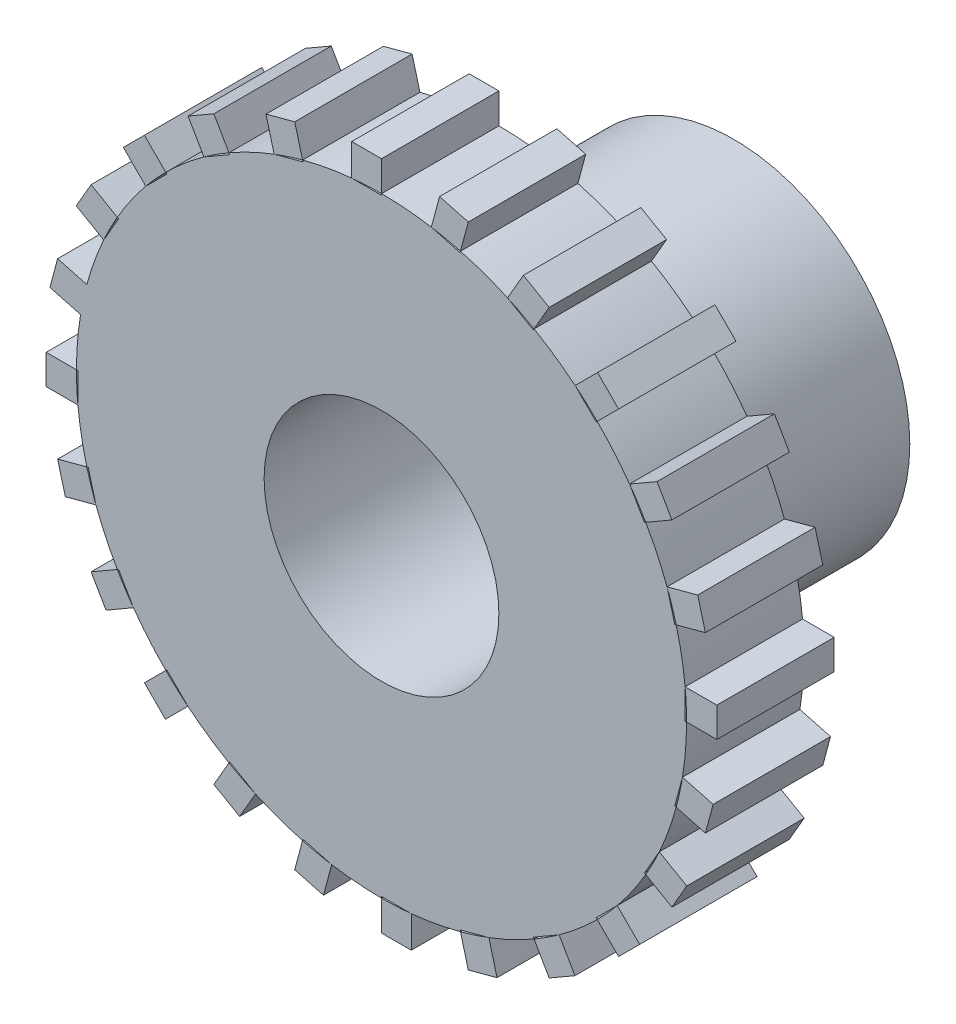
from build123d import *

# Parameters (mm, degrees)
SKETCH1_R           = 9.525
SKETCH1_R_2         = 6.35
BOSS_EXTRUDE1_DEPTH = 12.7
SKETCH2_R           = 6.35
BOSS_EXTRUDE2_DEPTH = 6.35


with BuildPart() as part:
    # Sketch1 → Boss-Extrude1 (new body)
    with BuildSketch(Plane.XY):
        Circle(SKETCH1_R)
        Circle(SKETCH1_R_2, mode=Mode.SUBTRACT)
    extrude(amount=BOSS_EXTRUDE1_DEPTH)

    # Sketch2 → Boss-Extrude2 (add)
    # profile 1 of 24: a face of its own
    with BuildSketch(Plane.XY.offset(12.7)):
        with BuildLine():
            Line((3.139117874, 17.93550241), (2.695169358, 16.278663993))
            ThreePointArc((2.695169358, 16.278663993), (3.487038215, 16.127597581), (4.27058357, 15.938034861))
            Line((4.27058357, 15.938034861), (4.694156627, 17.518831032))
            Line((4.694156627, 17.518831032), (3.139117874, 17.93550241))
        make_face()
    # profile 2 of 24: a face of its own
    with BuildSketch(Plane.XY.offset(12.7)):
        with BuildLine():
            Line((4.250208111, 15.861992615), (2.695169358, 16.278663993))
            ThreePointArc((2.695169358, 16.278663993), (1.352132218, 16.444773569), (0, 16.500267854))
            Line((0, 16.500267854), (0, 16.421543128))
            Line((0, 16.421543128), (-1.609894581, 16.421543128))
            ThreePointArc((-1.609894581, 16.421543128), (-2.950161162, 16.234389067), (-4.27058357, 15.938034861))
            Line((-4.27058357, 15.938034861), (-4.250208111, 15.861992615))
            Line((-4.250208111, 15.861992615), (-5.805246865, 15.445321237))
            ThreePointArc((-5.805246865, 15.445321237), (-7.051405934, 14.917657779), (-8.250133927, 14.289651131))
            Line((-8.250133927, 14.289651131), (-8.210771564, 14.221473518))
            Line((-8.210771564, 14.221473518), (-9.604981168, 13.416526228))
            ThreePointArc((-9.604981168, 13.416526228), (-10.672109045, 12.584312766), (-11.667451291, 11.667451291))
            Line((-11.667451291, 11.667451291), (-11.611784503, 11.611784503))
            Line((-11.611784503, 11.611784503), (-12.750151878, 10.473417128))
            ThreePointArc((-12.750151878, 10.473417128), (-13.565525561, 9.393367634), (-14.289651131, 8.250133927))
            Line((-14.289651131, 8.250133927), (-14.221473518, 8.210771564))
            Line((-14.221473518, 8.210771564), (-15.026420809, 6.816561959))
            ThreePointArc((-15.026420809, 6.816561959), (-15.534473928, 5.562280022), (-15.938034861, 4.27058357))
            Line((-15.938034861, 4.27058357), (-17.518831032, 4.694156627))
            Line((-17.518831032, 4.694156627), (-17.93550241, 3.139117874))
            Line((-17.93550241, 3.139117874), (-16.278663993, 2.695169358))
            ThreePointArc((-16.278663993, 2.695169358), (-16.444773569, 1.352132218), (-16.500267854, 0))
            Line((-16.500267854, 0), (-16.421543128, 0))
            Line((-16.421543128, 0), (-16.421543128, -1.609894581))
            ThreePointArc((-16.421543128, -1.609894581), (-16.234389067, -2.950161162), (-15.938034861, -4.27058357))
            Line((-15.938034861, -4.27058357), (-15.861992615, -4.250208111))
            Line((-15.861992615, -4.250208111), (-15.445321237, -5.805246865))
            ThreePointArc((-15.445321237, -5.805246865), (-14.917657779, -7.051405934), (-14.289651131, -8.250133927))
            Line((-14.289651131, -8.250133927), (-14.221473518, -8.210771564))
            Line((-14.221473518, -8.210771564), (-13.416526228, -9.604981168))
            ThreePointArc((-13.416526228, -9.604981168), (-12.584312766, -10.672109045), (-11.667451291, -11.667451291))
            Line((-11.667451291, -11.667451291), (-11.611784503, -11.611784503))
            Line((-11.611784503, -11.611784503), (-10.473417128, -12.750151878))
            ThreePointArc((-10.473417128, -12.750151878), (-9.393367634, -13.565525561), (-8.250133927, -14.289651131))
            Line((-8.250133927, -14.289651131), (-8.210771564, -14.221473518))
            Line((-8.210771564, -14.221473518), (-6.816561959, -15.026420809))
            ThreePointArc((-6.816561959, -15.026420809), (-5.562280022, -15.534473928), (-4.27058357, -15.938034861))
            Line((-4.27058357, -15.938034861), (-4.250208111, -15.861992615))
            Line((-4.250208111, -15.861992615), (-2.695169358, -16.278663993))
            ThreePointArc((-2.695169358, -16.278663993), (-1.352132218, -16.444773569), (0, -16.500267854))
            Line((0, -16.500267854), (0, -16.421543128))
            Line((0, -16.421543128), (1.609894581, -16.421543128))
            ThreePointArc((1.609894581, -16.421543128), (2.950161162, -16.234389067), (4.27058357, -15.938034861))
            Line((4.27058357, -15.938034861), (4.250208111, -15.861992615))
            Line((4.250208111, -15.861992615), (5.805246865, -15.445321237))
            ThreePointArc((5.805246865, -15.445321237), (7.051405934, -14.917657779), (8.250133927, -14.289651131))
            Line((8.250133927, -14.289651131), (8.210771564, -14.221473518))
            Line((8.210771564, -14.221473518), (9.604981168, -13.416526228))
            ThreePointArc((9.604981168, -13.416526228), (10.672109045, -12.584312766), (11.667451291, -11.667451291))
            Line((11.667451291, -11.667451291), (11.611784503, -11.611784503))
            Line((11.611784503, -11.611784503), (12.750151878, -10.473417128))
            ThreePointArc((12.750151878, -10.473417128), (13.565525561, -9.393367634), (14.289651131, -8.250133927))
            Line((14.289651131, -8.250133927), (14.221473518, -8.210771564))
            Line((14.221473518, -8.210771564), (15.026420809, -6.816561959))
            ThreePointArc((15.026420809, -6.816561959), (15.534473928, -5.562280022), (15.938034861, -4.27058357))
            Line((15.938034861, -4.27058357), (15.861992615, -4.250208111))
            Line((15.861992615, -4.250208111), (16.278663993, -2.695169358))
            ThreePointArc((16.278663993, -2.695169358), (16.444773569, -1.352132218), (16.500267854, 0))
            Line((16.500267854, 0), (16.421543128, 0))
            Line((16.421543128, 0), (16.421543128, 1.609894581))
            ThreePointArc((16.421543128, 1.609894581), (16.234389067, 2.950161162), (15.938034861, 4.27058357))
            Line((15.938034861, 4.27058357), (15.861992615, 4.250208111))
            Line((15.861992615, 4.250208111), (15.445321237, 5.805246865))
            ThreePointArc((15.445321237, 5.805246865), (14.917657779, 7.051405934), (14.289651131, 8.250133927))
            Line((14.289651131, 8.250133927), (14.221473518, 8.210771564))
            Line((14.221473518, 8.210771564), (13.416526228, 9.604981168))
            ThreePointArc((13.416526228, 9.604981168), (12.584312766, 10.672109045), (11.667451291, 11.667451291))
            Line((11.667451291, 11.667451291), (11.611784503, 11.611784503))
            Line((11.611784503, 11.611784503), (10.473417128, 12.750151878))
            ThreePointArc((10.473417128, 12.750151878), (9.393367634, 13.565525561), (8.250133927, 14.289651131))
            Line((8.250133927, 14.289651131), (8.210771564, 14.221473518))
            Line((8.210771564, 14.221473518), (6.816561959, 15.026420809))
            ThreePointArc((6.816561959, 15.026420809), (5.562280022, 15.534473928), (4.27058357, 15.938034861))
            Line((4.27058357, 15.938034861), (4.250208111, 15.861992615))
        make_face()
        Circle(SKETCH2_R, mode=Mode.SUBTRACT)
    # profile 3 of 24: a face of its own
    with BuildSketch(Plane.XY.offset(12.7)):
        with BuildLine():
            ThreePointArc((-1.609894581, 16.421543128), (-0.805909136, 16.480574921), (0, 16.500267854))
            Line((0, 16.500267854), (0, 18.136828476))
            Line((0, 18.136828476), (-1.609894581, 18.136828476))
            Line((-1.609894581, 18.136828476), (-1.609894581, 16.421543128))
        make_face()
    # profile 4 of 24: a face of its own
    with BuildSketch(Plane.XY.offset(12.7)):
        with BuildLine():
            Line((7.674204634, 16.511901495), (6.816561959, 15.026420809))
            ThreePointArc((6.816561959, 15.026420809), (7.542349675, 14.675551119), (8.250133927, 14.289651131))
            Line((8.250133927, 14.289651131), (9.068414238, 15.706954204))
            Line((9.068414238, 15.706954204), (7.674204634, 16.511901495))
        make_face()
    # profile 5 of 24: a face of its own
    with BuildSketch(Plane.XY.offset(12.7)):
        with BuildLine():
            ThreePointArc((-5.805246865, 15.445321237), (-5.043935112, 15.710428315), (-4.27058357, 15.938034861))
            Line((-4.27058357, 15.938034861), (-4.694156627, 17.518831032))
            Line((-4.694156627, 17.518831032), (-6.249195381, 17.102159654))
            Line((-6.249195381, 17.102159654), (-5.805246865, 15.445321237))
        make_face()
    # profile 6 of 24: a face of its own
    with BuildSketch(Plane.XY.offset(12.7)):
        with BuildLine():
            Line((11.68630703, 13.96304178), (10.473417128, 12.750151878))
            ThreePointArc((10.473417128, 12.750151878), (11.083662469, 12.2233901), (11.667451291, 11.667451291))
            Line((11.667451291, 11.667451291), (12.824674405, 12.824674405))
            Line((12.824674405, 12.824674405), (11.68630703, 13.96304178))
        make_face()
    # profile 7 of 24: a face of its own
    with BuildSketch(Plane.XY.offset(12.7)):
        with BuildLine():
            ThreePointArc((-9.604981168, 13.416526228), (-8.938225246, 13.869641982), (-8.250133927, 14.289651131))
            Line((-8.250133927, 14.289651131), (-9.068414238, 15.706954204))
            Line((-9.068414238, 15.706954204), (-10.462623843, 14.902006914))
            Line((-10.462623843, 14.902006914), (-9.604981168, 13.416526228))
        make_face()
    # profile 8 of 24: a face of its own
    with BuildSketch(Plane.XY.offset(12.7)):
        with BuildLine():
            Line((14.902006914, 10.462623843), (13.416526228, 9.604981168))
            ThreePointArc((13.416526228, 9.604981168), (13.869641982, 8.938225246), (14.289651131, 8.250133927))
            Line((14.289651131, 8.250133927), (15.706954204, 9.068414238))
            Line((15.706954204, 9.068414238), (14.902006914, 10.462623843))
        make_face()
    # profile 9 of 24: a face of its own
    with BuildSketch(Plane.XY.offset(12.7)):
        with BuildLine():
            ThreePointArc((-12.750151878, 10.473417128), (-12.2233901, 11.083662469), (-11.667451291, 11.667451291))
            Line((-11.667451291, 11.667451291), (-12.824674405, 12.824674405))
            Line((-12.824674405, 12.824674405), (-13.96304178, 11.68630703))
            Line((-13.96304178, 11.68630703), (-12.750151878, 10.473417128))
        make_face()
    # profile 10 of 24: a face of its own
    with BuildSketch(Plane.XY.offset(12.7)):
        with BuildLine():
            Line((17.102159654, 6.249195381), (15.445321237, 5.805246865))
            ThreePointArc((15.445321237, 5.805246865), (15.710428315, 5.043935112), (15.938034861, 4.27058357))
            Line((15.938034861, 4.27058357), (17.518831032, 4.694156627))
            Line((17.518831032, 4.694156627), (17.102159654, 6.249195381))
        make_face()
    # profile 11 of 24: a face of its own
    with BuildSketch(Plane.XY.offset(12.7)):
        with BuildLine():
            ThreePointArc((-15.026420809, 6.816561959), (-14.675551119, 7.542349675), (-14.289651131, 8.250133927))
            Line((-14.289651131, 8.250133927), (-15.706954204, 9.068414238))
            Line((-15.706954204, 9.068414238), (-16.511901495, 7.674204634))
            Line((-16.511901495, 7.674204634), (-15.026420809, 6.816561959))
        make_face()
    # profile 12 of 24: a face of its own
    with BuildSketch(Plane.XY.offset(12.7)):
        with BuildLine():
            Line((18.136828476, 1.609894581), (16.421543128, 1.609894581))
            ThreePointArc((16.421543128, 1.609894581), (16.480574921, 0.805909136), (16.500267854, 0))
            Line((16.500267854, 0), (18.136828476, 0))
            Line((18.136828476, 0), (18.136828476, 1.609894581))
        make_face()
    # profile 13 of 24: a face of its own
    with BuildSketch(Plane.XY.offset(12.7)):
        with BuildLine():
            Line((17.93550241, -3.139117874), (16.278663993, -2.695169358))
            ThreePointArc((16.278663993, -2.695169358), (16.127597581, -3.487038215), (15.938034861, -4.27058357))
            Line((15.938034861, -4.27058357), (17.518831032, -4.694156627))
            Line((17.518831032, -4.694156627), (17.93550241, -3.139117874))
        make_face()
    # profile 14 of 24: a face of its own
    with BuildSketch(Plane.XY.offset(12.7)):
        with BuildLine():
            ThreePointArc((-16.421543128, -1.609894581), (-16.480574921, -0.805909136), (-16.500267854, 0))
            Line((-16.500267854, 0), (-18.136828476, 0))
            Line((-18.136828476, 0), (-18.136828476, -1.609894581))
            Line((-18.136828476, -1.609894581), (-16.421543128, -1.609894581))
        make_face()
    # profile 15 of 24: a face of its own
    with BuildSketch(Plane.XY.offset(12.7)):
        with BuildLine():
            Line((16.511901495, -7.674204634), (15.026420809, -6.816561959))
            ThreePointArc((15.026420809, -6.816561959), (14.675551119, -7.542349675), (14.289651131, -8.250133927))
            Line((14.289651131, -8.250133927), (15.706954204, -9.068414238))
            Line((15.706954204, -9.068414238), (16.511901495, -7.674204634))
        make_face()
    # profile 16 of 24: a face of its own
    with BuildSketch(Plane.XY.offset(12.7)):
        with BuildLine():
            ThreePointArc((-15.445321237, -5.805246865), (-15.710428315, -5.043935112), (-15.938034861, -4.27058357))
            Line((-15.938034861, -4.27058357), (-17.518831032, -4.694156627))
            Line((-17.518831032, -4.694156627), (-17.102159654, -6.249195381))
            Line((-17.102159654, -6.249195381), (-15.445321237, -5.805246865))
        make_face()
    # profile 17 of 24: a face of its own
    with BuildSketch(Plane.XY.offset(12.7)):
        with BuildLine():
            Line((13.96304178, -11.68630703), (12.750151878, -10.473417128))
            ThreePointArc((12.750151878, -10.473417128), (12.2233901, -11.083662469), (11.667451291, -11.667451291))
            Line((11.667451291, -11.667451291), (12.824674405, -12.824674405))
            Line((12.824674405, -12.824674405), (13.96304178, -11.68630703))
        make_face()
    # profile 18 of 24: a face of its own
    with BuildSketch(Plane.XY.offset(12.7)):
        with BuildLine():
            ThreePointArc((-13.416526228, -9.604981168), (-13.869641982, -8.938225246), (-14.289651131, -8.250133927))
            Line((-14.289651131, -8.250133927), (-15.706954204, -9.068414238))
            Line((-15.706954204, -9.068414238), (-14.902006914, -10.462623843))
            Line((-14.902006914, -10.462623843), (-13.416526228, -9.604981168))
        make_face()
    # profile 19 of 24: a face of its own
    with BuildSketch(Plane.XY.offset(12.7)):
        with BuildLine():
            Line((10.462623843, -14.902006914), (9.604981168, -13.416526228))
            ThreePointArc((9.604981168, -13.416526228), (8.938225246, -13.869641982), (8.250133927, -14.289651131))
            Line((8.250133927, -14.289651131), (9.068414238, -15.706954204))
            Line((9.068414238, -15.706954204), (10.462623843, -14.902006914))
        make_face()
    # profile 20 of 24: a face of its own
    with BuildSketch(Plane.XY.offset(12.7)):
        with BuildLine():
            ThreePointArc((-10.473417128, -12.750151878), (-11.083662469, -12.2233901), (-11.667451291, -11.667451291))
            Line((-11.667451291, -11.667451291), (-12.824674405, -12.824674405))
            Line((-12.824674405, -12.824674405), (-11.68630703, -13.96304178))
            Line((-11.68630703, -13.96304178), (-10.473417128, -12.750151878))
        make_face()
    # profile 21 of 24: a face of its own
    with BuildSketch(Plane.XY.offset(12.7)):
        with BuildLine():
            Line((6.249195381, -17.102159654), (5.805246865, -15.445321237))
            ThreePointArc((5.805246865, -15.445321237), (5.043935112, -15.710428315), (4.27058357, -15.938034861))
            Line((4.27058357, -15.938034861), (4.694156627, -17.518831032))
            Line((4.694156627, -17.518831032), (6.249195381, -17.102159654))
        make_face()
    # profile 22 of 24: a face of its own
    with BuildSketch(Plane.XY.offset(12.7)):
        with BuildLine():
            ThreePointArc((-6.816561959, -15.026420809), (-7.542349675, -14.675551119), (-8.250133927, -14.289651131))
            Line((-8.250133927, -14.289651131), (-9.068414238, -15.706954204))
            Line((-9.068414238, -15.706954204), (-7.674204634, -16.511901495))
            Line((-7.674204634, -16.511901495), (-6.816561959, -15.026420809))
        make_face()
    # profile 23 of 24: a face of its own
    with BuildSketch(Plane.XY.offset(12.7)):
        with BuildLine():
            Line((1.609894581, -18.136828476), (1.609894581, -16.421543128))
            ThreePointArc((1.609894581, -16.421543128), (0.805909136, -16.480574921), (0, -16.500267854))
            Line((0, -16.500267854), (0, -18.136828476))
            Line((0, -18.136828476), (1.609894581, -18.136828476))
        make_face()
    # profile 24 of 24: a face of its own
    with BuildSketch(Plane.XY.offset(12.7)):
        with BuildLine():
            ThreePointArc((-2.695169358, -16.278663993), (-3.487038215, -16.127597581), (-4.27058357, -15.938034861))
            Line((-4.27058357, -15.938034861), (-4.694156627, -17.518831032))
            Line((-4.694156627, -17.518831032), (-3.139117874, -17.93550241))
            Line((-3.139117874, -17.93550241), (-2.695169358, -16.278663993))
        make_face()
    extrude(amount=BOSS_EXTRUDE2_DEPTH)


solid = part.part
